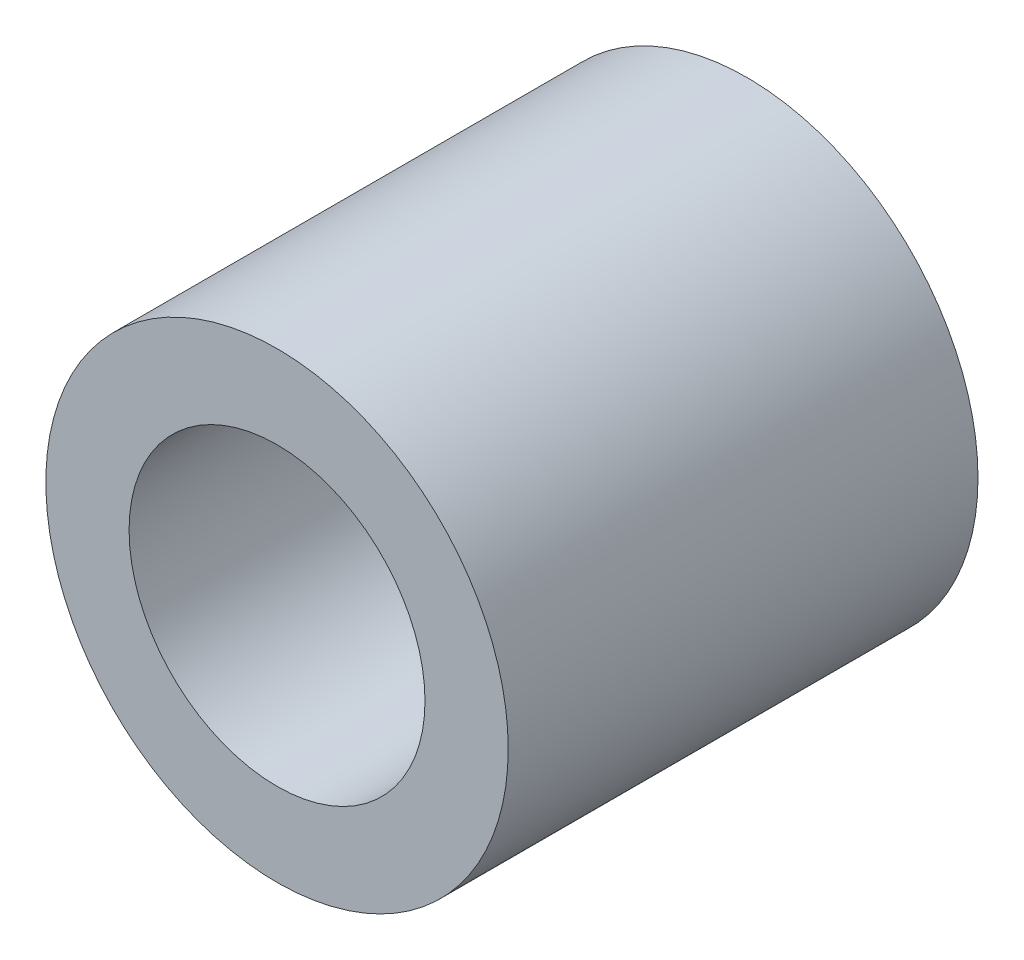
from build123d import *

# Parameters (mm, degrees)
SKETCH1_R           = 2.5
SKETCH1_R_2         = 1.6
BOSS_EXTRUDE1_DEPTH = 5.08


with BuildPart() as part:
    # Sketch1 → Boss-Extrude1 (new body)
    with BuildSketch(Plane.XY):
        Circle(SKETCH1_R)
        Circle(SKETCH1_R_2, mode=Mode.SUBTRACT)
    extrude(amount=BOSS_EXTRUDE1_DEPTH)


solid = part.part
